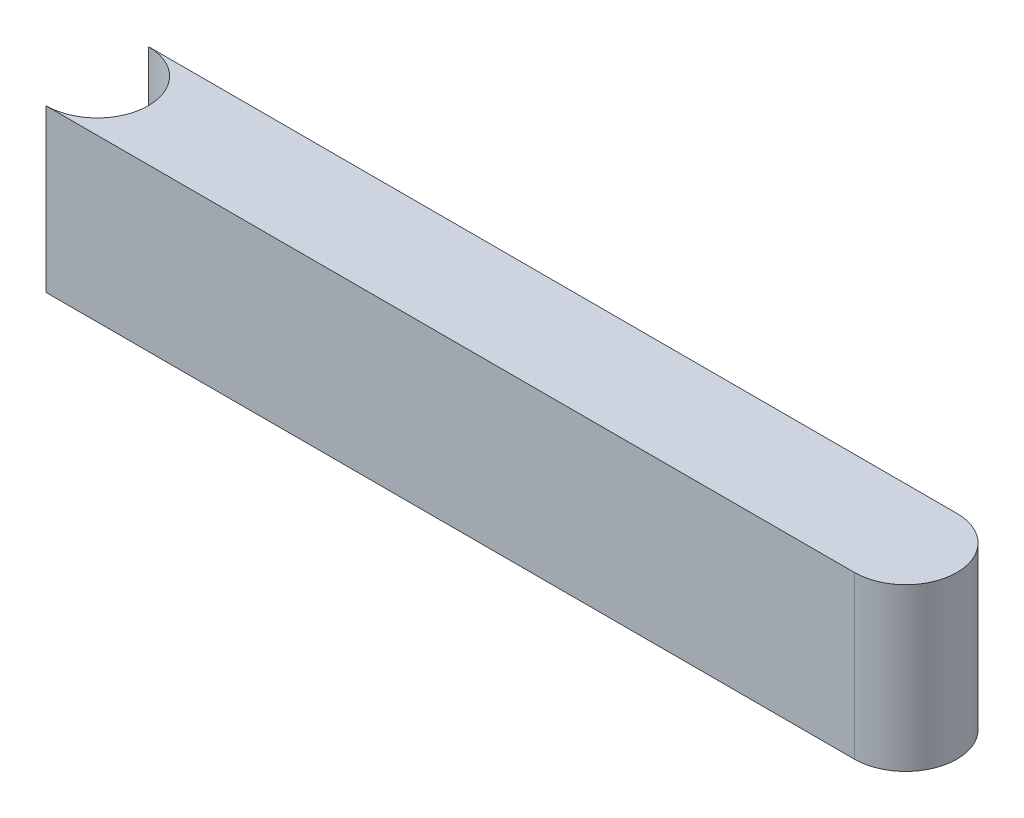
from build123d import *

# Parameters (mm, degrees)
BOSS_EXTRUDE1_DEPTH = 30


with BuildPart() as part:
    # Sketch1 → Boss-Extrude1 (new body)
    with BuildSketch(Plane(origin=(0, 0, 0), x_dir=(1, 0, 0), z_dir=(0, 1, 0))):
        with BuildLine():
            Line((0, 0), (150, 0))
            ThreePointArc((150, 0), (159.5, -9.5), (150, -19))
            Line((150, -19), (0, -19))
            ThreePointArc((0, -19), (9.5, -9.5), (0, 0))
        make_face()
    extrude(amount=BOSS_EXTRUDE1_DEPTH)


solid = part.part
